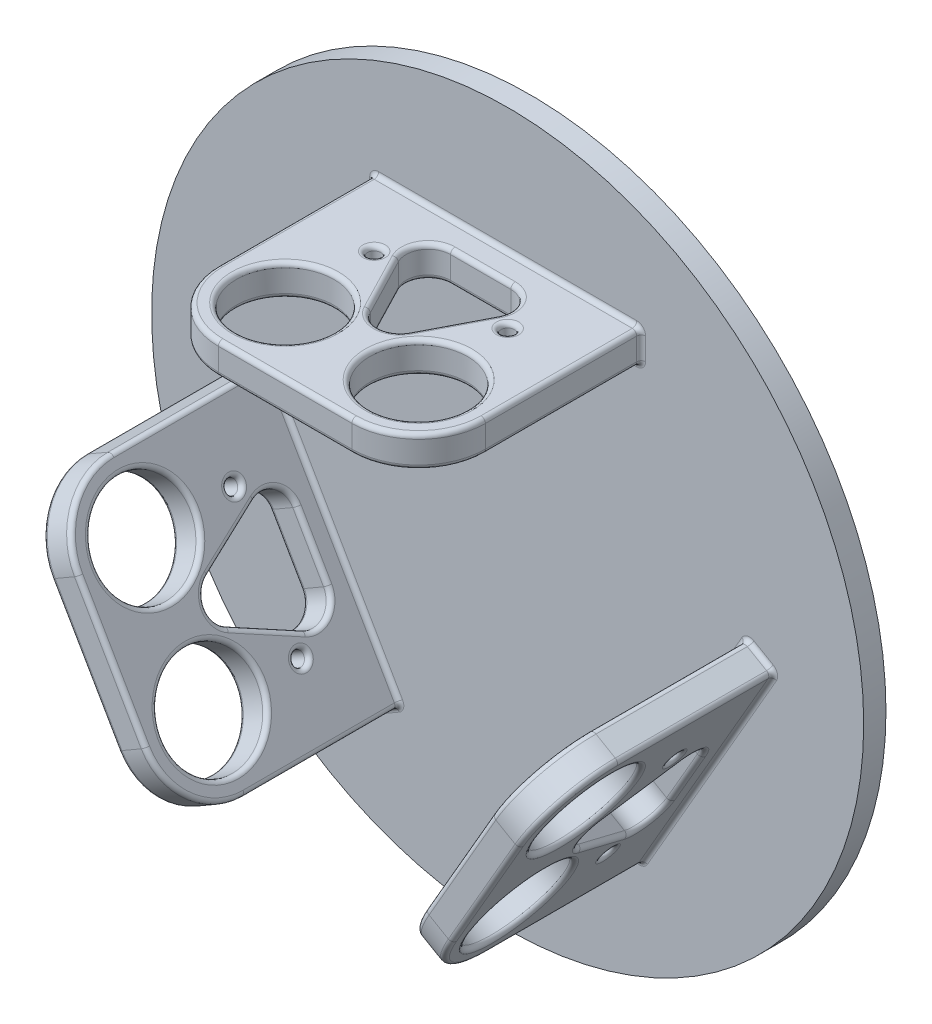
from build123d import *

# Parameters (mm, degrees)
ESQUISSE1_R      = 80
EXTRUSION1_DEPTH = 5
ESQUISSE4_W      = 60
ESQUISSE4_H      = 7
EXTRUSION2_DEPTH = 50
EXTRUSION3_REACH = 174.9
ESQUISSE5_R      = 11
ESQUISSE5_R_2    = 1.5
EXTRUSION4_REACH = 174.9
ESQUISSE6_R      = 11
ESQUISSE6_R_2    = 1.5
EXTRUSION5_REACH = 165.857
ESQUISSE7_R      = 11
ESQUISSE7_R_2    = 1.5
CONG_1_R         = 15
CONG_2_R         = 1


with BuildPart() as part:
    # Esquisse1 → Extrusion1 (new body)
    with BuildSketch(Plane.XY):
        Circle(ESQUISSE1_R)
    extrude(amount=EXTRUSION1_DEPTH)

    # Esquisse4 → Extrusion2 (add)
    with BuildSketch(Plane.XY.offset(5)):
        Polygon((-60.033320997, -0.019237886), (-53.97114317, 3.480762114), (-23.97114317, -48.480762114), (-30.033320997, -51.980762114), align=None)
        with Locations((0, 48.5)):
            Rectangle(ESQUISSE4_W, ESQUISSE4_H)
        Polygon((53.97114317, 3.480762114), (60.033320997, -0.019237886), (30.033320997, -51.980762114), (23.97114317, -48.480762114), align=None)
    extrude(amount=EXTRUSION2_DEPTH)

    # Esquisse5 → Extrusion3 (cut, up to next)
    with BuildSketch(Plane(origin=(-45.033320997, -26, 0), x_dir=(0, 0, 1), z_dir=(-0.8660254037844385, -0.5000000000000001, 0)), mode=Mode.PRIVATE) as extrusion3_sk1:
        with Locations(Location((40, 15, 0), (0, 0, 270))):
            Circle(ESQUISSE5_R)
    extrusion3_tool1 = extrude(extrusion3_sk1.sketch, amount=-EXTRUSION3_REACH, mode=Mode.PRIVATE) & part.part
    # Esquisse5 → Extrusion3 (cut, up to next)
    with BuildSketch(Plane(origin=(-45.033320997, -26, 0), x_dir=(0, 0, 1), z_dir=(-0.8660254037844385, -0.5000000000000001, 0)), mode=Mode.PRIVATE) as extrusion3_sk2:
        with Locations(Location((40, -15, 0), (0, 0, 270))):
            Circle(ESQUISSE5_R)
    extrusion3_tool2 = extrude(extrusion3_sk2.sketch, amount=-EXTRUSION3_REACH, mode=Mode.PRIVATE) & part.part
    # Esquisse5 → Extrusion3 (cut, up to next)
    with BuildSketch(Plane(origin=(-45.033320997, -26, 0), x_dir=(0, 0, 1), z_dir=(-0.8660254037844385, -0.5000000000000001, 0)), mode=Mode.PRIVATE) as extrusion3_sk3:
        with Locations(Location((20, 15, 0), (0, 0, 270))):
            Circle(ESQUISSE5_R_2)
    extrusion3_tool3 = extrude(extrusion3_sk3.sketch, amount=-EXTRUSION3_REACH, mode=Mode.PRIVATE) & part.part
    # Esquisse5 → Extrusion3 (cut, up to next)
    with BuildSketch(Plane(origin=(-45.033320997, -26, 0), x_dir=(0, 0, 1), z_dir=(-0.8660254037844385, -0.5000000000000001, 0)), mode=Mode.PRIVATE) as extrusion3_sk4:
        with Locations(Location((20, -15, 0), (0, 0, 270))):
            Circle(ESQUISSE5_R_2)
    extrusion3_tool4 = extrude(extrusion3_sk4.sketch, amount=-EXTRUSION3_REACH, mode=Mode.PRIVATE) & part.part
    # Esquisse5 → Extrusion3 (cut, up to next)
    with BuildSketch(Plane(origin=(-45.033320997, -26, 0), x_dir=(0, 0, 1), z_dir=(-0.8660254037844385, -0.5000000000000001, 0)), mode=Mode.PRIVATE) as extrusion3_sk5:
        with BuildLine():
            Line((31.05572809, 4.472135955), (17.236067977, 11.381966011))
            ThreePointArc((17.236067977, 11.381966011), (12.371344439, 11.163084098), (10, 6.909830056))
            Line((10, 6.909830056), (10, -6.909830056))
            ThreePointArc((10, -6.909830056), (12.371344439, -11.163084098), (17.236067977, -11.381966011))
            Line((17.236067977, -11.381966011), (31.05572809, -4.472135955))
            ThreePointArc((31.05572809, -4.472135955), (33.819660113, 0), (31.05572809, 4.472135955))
        make_face()
    extrusion3_tool5 = extrude(extrusion3_sk5.sketch, amount=-EXTRUSION3_REACH, mode=Mode.PRIVATE) & part.part
    add(extrusion3_tool1.solids().sort_by_distance((-52.533321, -13.009619, 40))[0], mode=Mode.SUBTRACT)
    add(extrusion3_tool2.solids().sort_by_distance((-37.533321, -38.990381, 40))[0], mode=Mode.SUBTRACT)
    add(extrusion3_tool3.solids().sort_by_distance((-52.533321, -13.009619, 20))[0], mode=Mode.SUBTRACT)
    add(extrusion3_tool4.solids().sort_by_distance((-37.533321, -38.990381, 20))[0], mode=Mode.SUBTRACT)
    add(extrusion3_tool5.solids().sort_by_distance((-45.033321, -26, 19.753127))[0], mode=Mode.SUBTRACT)

    # Esquisse6 → Extrusion4 (cut, up to next)
    with BuildSketch(Plane(origin=(45.033320997, -26, 0), x_dir=(0, 0, -1), z_dir=(0.8660254037844386, -0.4999999999999999, 0)), mode=Mode.PRIVATE) as extrusion4_sk1:
        with Locations(Location((-40, 15, 0), (0, 0, 90))):
            Circle(ESQUISSE6_R)
    extrusion4_tool1 = extrude(extrusion4_sk1.sketch, amount=-EXTRUSION4_REACH, mode=Mode.PRIVATE) & part.part
    # Esquisse6 → Extrusion4 (cut, up to next)
    with BuildSketch(Plane(origin=(45.033320997, -26, 0), x_dir=(0, 0, -1), z_dir=(0.8660254037844386, -0.4999999999999999, 0)), mode=Mode.PRIVATE) as extrusion4_sk2:
        with Locations(Location((-40, -15, 0), (0, 0, 90))):
            Circle(ESQUISSE6_R)
    extrusion4_tool2 = extrude(extrusion4_sk2.sketch, amount=-EXTRUSION4_REACH, mode=Mode.PRIVATE) & part.part
    # Esquisse6 → Extrusion4 (cut, up to next)
    with BuildSketch(Plane(origin=(45.033320997, -26, 0), x_dir=(0, 0, -1), z_dir=(0.8660254037844386, -0.4999999999999999, 0)), mode=Mode.PRIVATE) as extrusion4_sk3:
        with Locations(Location((-20, 15, 0), (0, 0, 90))):
            Circle(ESQUISSE6_R_2)
    extrusion4_tool3 = extrude(extrusion4_sk3.sketch, amount=-EXTRUSION4_REACH, mode=Mode.PRIVATE) & part.part
    # Esquisse6 → Extrusion4 (cut, up to next)
    with BuildSketch(Plane(origin=(45.033320997, -26, 0), x_dir=(0, 0, -1), z_dir=(0.8660254037844386, -0.4999999999999999, 0)), mode=Mode.PRIVATE) as extrusion4_sk4:
        with Locations(Location((-20, -15, 0), (0, 0, 90))):
            Circle(ESQUISSE6_R_2)
    extrusion4_tool4 = extrude(extrusion4_sk4.sketch, amount=-EXTRUSION4_REACH, mode=Mode.PRIVATE) & part.part
    # Esquisse6 → Extrusion4 (cut, up to next)
    with BuildSketch(Plane(origin=(45.033320997, -26, 0), x_dir=(0, 0, -1), z_dir=(0.8660254037844386, -0.4999999999999999, 0)), mode=Mode.PRIVATE) as extrusion4_sk5:
        with BuildLine():
            Line((-10, 6.909830056), (-10, -6.909830056))
            ThreePointArc((-10, -6.909830056), (-12.371344439, -11.163084098), (-17.236067977, -11.381966011))
            Line((-17.236067977, -11.381966011), (-31.05572809, -4.472135955))
            ThreePointArc((-31.05572809, -4.472135955), (-33.819660113, 0), (-31.05572809, 4.472135955))
            Line((-31.05572809, 4.472135955), (-17.236067977, 11.381966011))
            ThreePointArc((-17.236067977, 11.381966011), (-12.371344439, 11.163084098), (-10, 6.909830056))
        make_face()
    extrusion4_tool5 = extrude(extrusion4_sk5.sketch, amount=-EXTRUSION4_REACH, mode=Mode.PRIVATE) & part.part
    add(extrusion4_tool1.solids().sort_by_distance((52.533321, -13.009619, 40))[0], mode=Mode.SUBTRACT)
    add(extrusion4_tool2.solids().sort_by_distance((37.533321, -38.990381, 40))[0], mode=Mode.SUBTRACT)
    add(extrusion4_tool3.solids().sort_by_distance((52.533321, -13.009619, 20))[0], mode=Mode.SUBTRACT)
    add(extrusion4_tool4.solids().sort_by_distance((37.533321, -38.990381, 20))[0], mode=Mode.SUBTRACT)
    add(extrusion4_tool5.solids().sort_by_distance((45.033321, -26, 19.753127))[0], mode=Mode.SUBTRACT)

    # Esquisse7 → Extrusion5 (cut, up to next)
    with BuildSketch(Plane(origin=(0, 52, 0), x_dir=(1, 0, 0), z_dir=(0, 1, 0)), mode=Mode.PRIVATE) as extrusion5_sk1:
        with Locations(Location((-15, -40, 0), (0, 0, 270))):
            Circle(ESQUISSE7_R)
    extrusion5_tool1 = extrude(extrusion5_sk1.sketch, amount=-EXTRUSION5_REACH, mode=Mode.PRIVATE) & part.part
    # Esquisse7 → Extrusion5 (cut, up to next)
    with BuildSketch(Plane(origin=(0, 52, 0), x_dir=(1, 0, 0), z_dir=(0, 1, 0)), mode=Mode.PRIVATE) as extrusion5_sk2:
        with Locations(Location((15, -40, 0), (0, 0, 270))):
            Circle(ESQUISSE7_R)
    extrusion5_tool2 = extrude(extrusion5_sk2.sketch, amount=-EXTRUSION5_REACH, mode=Mode.PRIVATE) & part.part
    # Esquisse7 → Extrusion5 (cut, up to next)
    with BuildSketch(Plane(origin=(0, 52, 0), x_dir=(1, 0, 0), z_dir=(0, 1, 0)), mode=Mode.PRIVATE) as extrusion5_sk3:
        with Locations(Location((-15, -20, 0), (0, 0, 270))):
            Circle(ESQUISSE7_R_2)
    extrusion5_tool3 = extrude(extrusion5_sk3.sketch, amount=-EXTRUSION5_REACH, mode=Mode.PRIVATE) & part.part
    # Esquisse7 → Extrusion5 (cut, up to next)
    with BuildSketch(Plane(origin=(0, 52, 0), x_dir=(1, 0, 0), z_dir=(0, 1, 0)), mode=Mode.PRIVATE) as extrusion5_sk4:
        with Locations(Location((15, -20, 0), (0, 0, 270))):
            Circle(ESQUISSE7_R_2)
    extrusion5_tool4 = extrude(extrusion5_sk4.sketch, amount=-EXTRUSION5_REACH, mode=Mode.PRIVATE) & part.part
    # Esquisse7 → Extrusion5 (cut, up to next)
    with BuildSketch(Plane(origin=(0, 52, 0), x_dir=(1, 0, 0), z_dir=(0, 1, 0)), mode=Mode.PRIVATE) as extrusion5_sk5:
        with BuildLine():
            Line((6.775803961, -11.06696488), (-6.775803961, -11.06696488))
            ThreePointArc((-6.775803961, -11.06696488), (-11.048187946, -13.469517078), (-11.214721717, -18.368270846))
            Line((-11.214721717, -18.368270846), (-4.438917757, -31.43790911))
            ThreePointArc((-4.438917757, -31.43790911), (0, -34.136603144), (4.438917757, -31.43790911))
            Line((4.438917757, -31.43790911), (11.214721717, -18.368270846))
            ThreePointArc((11.214721717, -18.368270846), (11.048187946, -13.469517078), (6.775803961, -11.06696488))
        make_face()
    extrusion5_tool5 = extrude(extrusion5_sk5.sketch, amount=-EXTRUSION5_REACH, mode=Mode.PRIVATE) & part.part
    add(extrusion5_tool1.solids().sort_by_distance((-15, 52, 40))[0], mode=Mode.SUBTRACT)
    add(extrusion5_tool2.solids().sort_by_distance((15, 52, 40))[0], mode=Mode.SUBTRACT)
    add(extrusion5_tool3.solids().sort_by_distance((-15, 52, 20))[0], mode=Mode.SUBTRACT)
    add(extrusion5_tool4.solids().sort_by_distance((15, 52, 20))[0], mode=Mode.SUBTRACT)
    add(extrusion5_tool5.solids().sort_by_distance((0, 52, 20.528965))[0], mode=Mode.SUBTRACT)

    # Congé1
    cong_1_edges = [part.edges().sort_by_distance(p)[0] for p in [
        (-30, 48.5, 55),
        (30, 48.5, 55),
        (27.002232084, -50.230762114, 55),
        (57.002232084, 1.730762114, 55),
        (-27.002232084, -50.230762114, 55),
        (-57.002232084, 1.730762114, 55),
    ]]
    fillet(cong_1_edges, radius=CONG_1_R)

    # Congé2
    cong_2_edges = [part.edges().sort_by_distance(p)[0] for p in [
        (-15, 52, 29),
        (-15, 45, 29),
        (15, 52, 29),
        (15, 45, 29),
        (-11.048187946, 52, 13.469517078),
        (-7.826819737, 52, 24.903089978),
        (0, 52, 34.136603144),
        (7.826819737, 52, 24.903089978),
        (11.048187946, 52, 13.469517078),
        (0, 52, 11.06696488),
        (-7.826819737, 45, 24.903089978),
        (-11.048187946, 45, 13.469517078),
        (0, 45, 11.06696488),
        (11.048187946, 45, 13.469517078),
        (7.826819737, 45, 24.903089978),
        (0, 45, 34.136603144),
        (-15, 52, 18.5),
        (-15, 45, 18.5),
        (15, 52, 18.5),
        (15, 45, 18.5),
        (38.97114317, -22.5, 55),
        (45.033320997, -26, 55),
        (60.033320997, -0.019237886, 22.5),
        (30.033320997, -51.980762114, 22.5),
        (57.836621856, -3.824032408, 50.606601718),
        (32.230020138, -48.175967592, 50.606601718),
        (23.97114317, -48.480762114, 22.5),
        (53.97114317, 3.480762114, 22.5),
        (51.774444029, -0.324032408, 50.606601718),
        (26.167842311, -44.675967592, 50.606601718),
        (-45.033320997, -26, 55),
        (-38.97114317, -22.5, 55),
        (-53.97114317, 3.480762114, 22.5),
        (-23.97114317, -48.480762114, 22.5),
        (-51.774444029, -0.324032408, 50.606601718),
        (-26.167842311, -44.675967592, 50.606601718),
        (-30.033320997, -51.980762114, 22.5),
        (-60.033320997, -0.019237886, 22.5),
        (-57.836621856, -3.824032408, 50.606601718),
        (-32.230020138, -48.175967592, 50.606601718),
        (0, 45, 55),
        (0, 52, 55),
        (30, 45, 22.5),
        (-30, 45, 22.5),
        (25.606601718, 45, 50.606601718),
        (-25.606601718, 45, 50.606601718),
        (-30, 52, 22.5),
        (30, 52, 22.5),
        (25.606601718, 52, 50.606601718),
        (-25.606601718, 52, 50.606601718),
        (-30, 48.5, 5),
        (0, 45, 5),
        (30, 48.5, 5),
        (0, 52, 5),
        (38.97114317, -22.5, 5),
        (27.002232084, -50.230762114, 5),
        (45.033320997, -26, 5),
        (57.002232084, 1.730762114, 5),
        (-58.033320997, -3.483339502, 40),
        (-51.97114317, 0.016660498, 40),
        (-43.033320997, -29.464101615, 40),
        (-36.97114317, -25.964101615, 40),
        (-53.283320997, -11.710580838, 20),
        (-47.22114317, -8.210580838, 20),
        (-38.283320997, -37.691342951, 20),
        (-32.22114317, -34.191342951, 20),
        (-50.614863046, -16.332485587, 12.371344439),
        (-45.033320997, -26, 10),
        (-39.451778948, -35.667514413, 12.371344439),
        (-41.069795505, -32.865027528, 24.145898034),
        (-45.033320997, -26, 33.819660113),
        (-48.996846488, -19.134972472, 24.145898034),
        (-38.97114317, -22.5, 10),
        (-44.552685219, -12.832485587, 12.371344439),
        (-42.934668662, -15.634972472, 24.145898034),
        (-38.97114317, -22.5, 33.819660113),
        (-35.007617679, -29.365027528, 24.145898034),
        (-33.389601121, -32.167514413, 12.371344439),
        (-45.033320997, -26, 5),
        (-27.002232084, -50.230762114, 5),
        (47.033320997, -22.535898385, 40),
        (40.97114317, -19.035898385, 40),
        (-38.97114317, -22.5, 5),
        (32.033320997, -48.516660498, 40),
        (25.97114317, -45.016660498, 40),
        (-57.002232084, 1.730762114, 5),
        (51.783320997, -14.308657049, 20),
        (45.72114317, -10.808657049, 20),
        (36.783320997, -40.289419162, 20),
        (30.72114317, -36.789419162, 20),
        (45.033320997, -26, 33.819660113),
        (41.069795505, -32.865027528, 24.145898034),
        (39.451778948, -35.667514413, 12.371344439),
        (45.033320997, -26, 10),
        (50.614863046, -16.332485587, 12.371344439),
        (48.996846488, -19.134972472, 24.145898034),
        (35.007617679, -29.365027528, 24.145898034),
        (38.97114317, -22.5, 33.819660113),
        (42.934668662, -15.634972472, 24.145898034),
        (44.552685219, -12.832485587, 12.371344439),
        (38.97114317, -22.5, 10),
        (33.389601121, -32.167514413, 12.371344439),
    ]]
    fillet(cong_2_edges, radius=CONG_2_R)


solid = part.part
